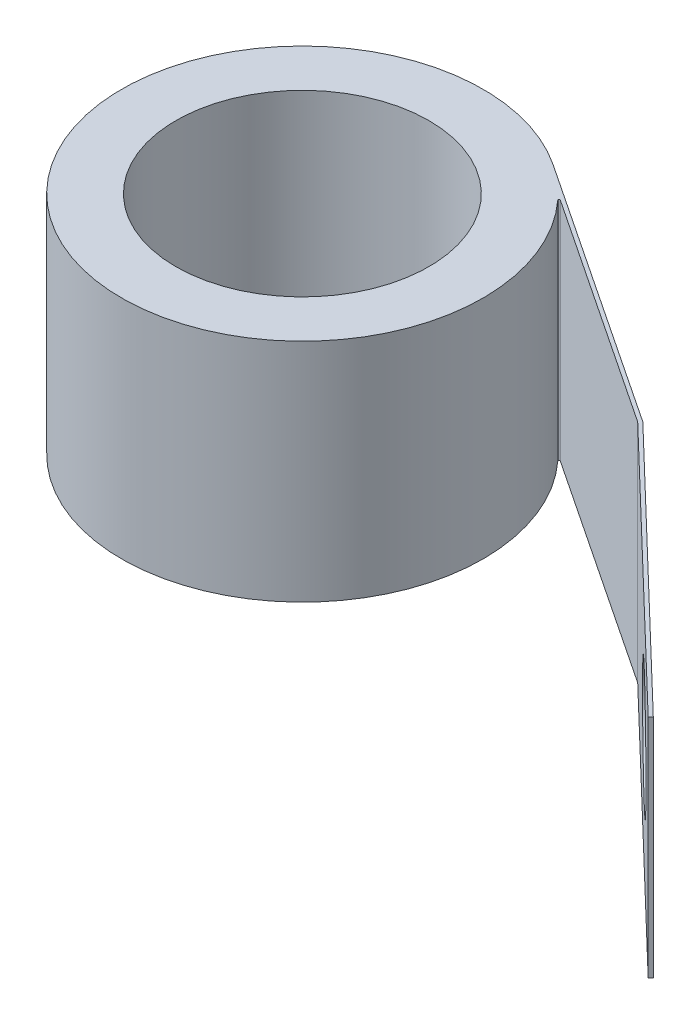
from build123d import *

# Parameters (mm, degrees)
SKETCH1_R           = 3.556
BOSS_EXTRUDE1_DEPTH = 6.35
SKETCH2_R           = 1.651
CUT_EXTRUDE1_DEPTH  = 6.35
FILLET1_R           = 0.0254


with BuildPart() as part:
    # Sketch1 → Boss-Extrude1 (new body)
    with BuildSketch(Plane(origin=(0, 0, 0), x_dir=(1, 0, 0), z_dir=(0, 1, 0))):
        with BuildLine():
            Line((17.664907311, -7.804824457), (10.3349883, -0.769350962))
            Line((10.3349883, -0.769350962), (2.811937974, 4.230768822))
            ThreePointArc((2.811937974, 4.230768822), (-3.21777664, -3.93094308), (3.5918694, 3.592335482))
            Line((3.5918694, 3.592335482), (10.264633565, -0.842650153))
            Line((10.264633565, -0.842650153), (17.594552576, -7.878123647))
            Line((17.594552576, -7.878123647), (17.664907311, -7.804824457))
        make_face()
        Circle(SKETCH1_R, mode=Mode.SUBTRACT)
    extrude(amount=BOSS_EXTRUDE1_DEPTH)

    # Sketch2 → Cut-Extrude1 (cut)
    with BuildSketch(Plane(origin=(3.836508416, 0, -5.468082617), x_dir=(-0.7214487215857361, 0, -0.6924678636025697), z_dir=(0.6924678636025697, 0, -0.7214487215857361))):
        with Locations((-15.35754231, 3.175)):
            Circle(SKETCH2_R)
    extrude(amount=-CUT_EXTRUDE1_DEPTH, mode=Mode.SUBTRACT)

    # Fillet1
    fillet1_edges = [part.edges().sort_by_distance(p)[0] for p in [
        (3.5918694, 3.175, -3.592335482),
    ]]
    fillet(fillet1_edges, radius=FILLET1_R)


solid = part.part
